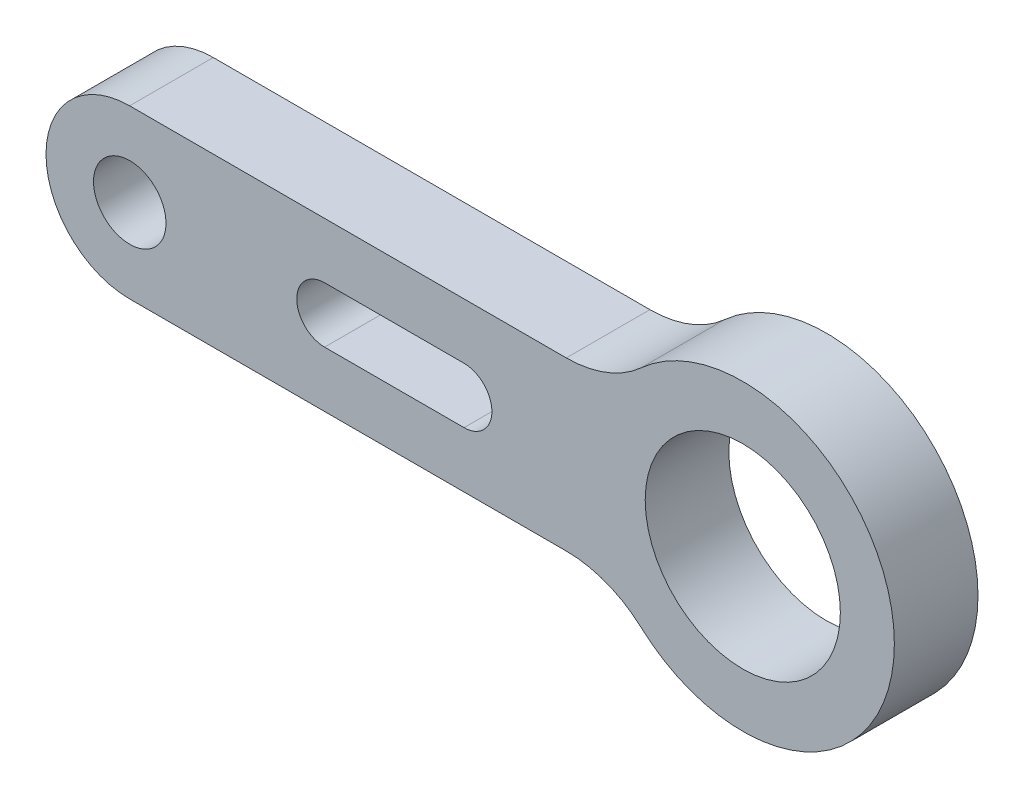
from build123d import *

# Parameters (mm, degrees)
SKETCH_1_R      = 3.5
SKETCH_1_R_2    = 1.3
EXTRUDE_1_DEPTH = 3


with BuildPart() as part:
    # 草图1 → 凸台-拉伸1 (new body)
    with BuildSketch(Plane.XY.offset(3)):
        with BuildLine():
            Line((17.542771769, 6.907119873), (1.879793686, 6.907119873))
            ThreePointArc((1.879793686, 6.907119873), (-1.120206314, 3.907119873), (1.879793686, 0.907119873))
            Line((1.879793686, 0.907119873), (17.544137719, 0.907119873))
            ThreePointArc((17.544137719, 0.907119873), (18.981359081, 0.640000095), (20.226625317, -0.125682749))
            ThreePointArc((20.226625317, -0.125682749), (29.310375688, 3.908267946), (20.225838323, 7.940446))
            ThreePointArc((20.225838323, 7.940446), (18.980357333, 7.174379894), (17.542771769, 6.907119873))
        make_face()
        with Locations(Location((23.87302906, 3.907737435, 0), (0, 0, 180))):
            Circle(SKETCH_1_R, mode=Mode.SUBTRACT)
        with Locations(Location((1.88402906, 3.907119873, 0), (0, 0, 180))):
            Circle(SKETCH_1_R_2, mode=Mode.SUBTRACT)
        with BuildLine():
            Line((8.87402906, 4.907386497), (13.87402906, 4.907386497))
            ThreePointArc((13.87402906, 4.907386497), (14.87402906, 3.907386497), (13.87402906, 2.907386497))
            Line((13.87402906, 2.907386497), (8.87402906, 2.907386497))
            ThreePointArc((8.87402906, 2.907386497), (7.87402906, 3.907386497), (8.87402906, 4.907386497))
        make_face(mode=Mode.SUBTRACT)
    extrude(amount=-EXTRUDE_1_DEPTH)


solid = part.part
